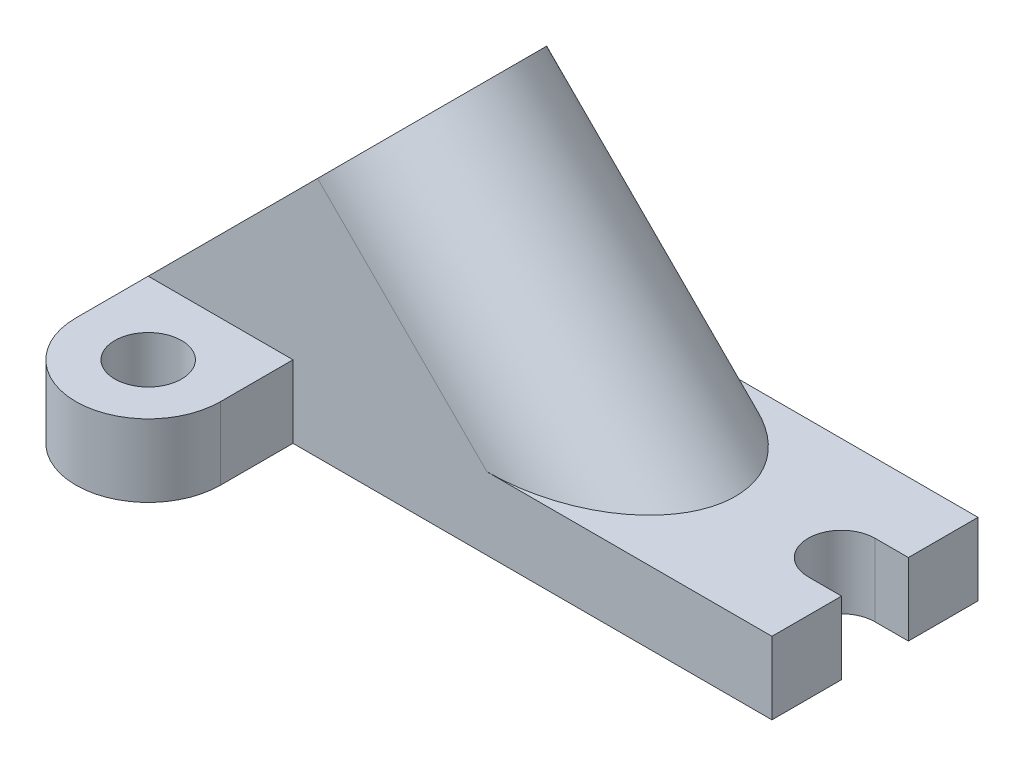
from build123d import *

# Parameters (mm, degrees)
SKETCH1_R           = 6
BOSS_EXTRUDE1_DEPTH = 13
SKETCH2_W           = 86
SKETCH2_H           = 13
BOSS_EXTRUDE2_DEPTH = 18.5
CUT_EXTRUDE1_DEPTH  = 37
SKETCH4_R           = 8
BOSS_EXTRUDE3_DEPTH = 64
SKETCH6_W           = 112
SKETCH6_H           = 33.393710728
CUT_EXTRUDE2_DEPTH  = 32
SKETCH7_R           = 8
CUT_EXTRUDE3_DEPTH  = 88


with BuildPart() as part:
    # Sketch1 → Boss-Extrude1 (new body)
    with BuildSketch(Plane(origin=(0, 0, 0), x_dir=(1, 0, 0), z_dir=(0, 1, 0))):
        with BuildLine():
            Line((13, 31.5), (13, -31.5))
            ThreePointArc((13, -31.5), (0, -44.5), (-13, -31.5))
            Line((-13, -31.5), (-13, 31.5))
            ThreePointArc((-13, 31.5), (0, 44.5), (13, 31.5))
        make_face()
        with Locations(Location((0, 31.5, 0), (0, 0, 90))):
            Circle(SKETCH1_R, mode=Mode.SUBTRACT)
        with Locations(Location((0, -31.5, 0), (0, 0, 90))):
            Circle(SKETCH1_R, mode=Mode.SUBTRACT)
    extrude(amount=BOSS_EXTRUDE1_DEPTH)

    # Sketch2 → Boss-Extrude2 (add, symmetric)
    with BuildSketch(Plane.XY):
        with Locations((56, 6.5)):
            Rectangle(SKETCH2_W, SKETCH2_H)
    extrude(amount=BOSS_EXTRUDE2_DEPTH, both=True)

    # Sketch3 → Cut-Extrude1 (cut)
    with BuildSketch(Plane(origin=(0, 13, 0), x_dir=(1, 0, 0), z_dir=(0, 1, 0))):
        with BuildLine():
            Line((105, -6), (93, -6))
            ThreePointArc((93, -6), (87, 0), (93, 6))
            Line((93, 6), (105, 6))
            ThreePointArc((105, 6), (111, 0), (105, -6))
        make_face()
    extrude(amount=-CUT_EXTRUDE1_DEPTH, mode=Mode.SUBTRACT)

    # Sketch4 → Boss-Extrude3 (add)
    with BuildSketch(Plane(origin=(-13, 13, 0), x_dir=(0, 0, 1), z_dir=(-0.7071067811865488, 0.7071067811865464, 0))):
        with BuildLine():
            Line((-18.5, 43), (-18.5, 0))
            Line((-18.5, 0), (18.5, 0))
            Line((18.5, 0), (18.5, 43))
            ThreePointArc((18.5, 43), (0, 61.5), (-18.5, 43))
        make_face()
        with Locations(Location((0, 43, 0), (0, 0, 270))):
            Circle(SKETCH4_R, mode=Mode.SUBTRACT)
    extrude(amount=-BOSS_EXTRUDE3_DEPTH)

    # Sketch6 → Cut-Extrude2 (cut, symmetric)
    with BuildSketch(Plane.XY):
        with Locations((43, -16.696855364)):
            Rectangle(SKETCH6_W, SKETCH6_H)
    extrude(amount=CUT_EXTRUDE2_DEPTH, both=True, mode=Mode.SUBTRACT)

    # Sketch7 → Cut-Extrude3 (cut)
    with BuildSketch(Plane(origin=(-13, 13, 0), x_dir=(0, 0, 1), z_dir=(-0.7071067811865487, 0.7071067811865465, 0))):
        with Locations(Location((0, 43, 0), (0, 0, 270))):
            Circle(SKETCH7_R)
    extrude(amount=-CUT_EXTRUDE3_DEPTH, mode=Mode.SUBTRACT)


solid = part.part
